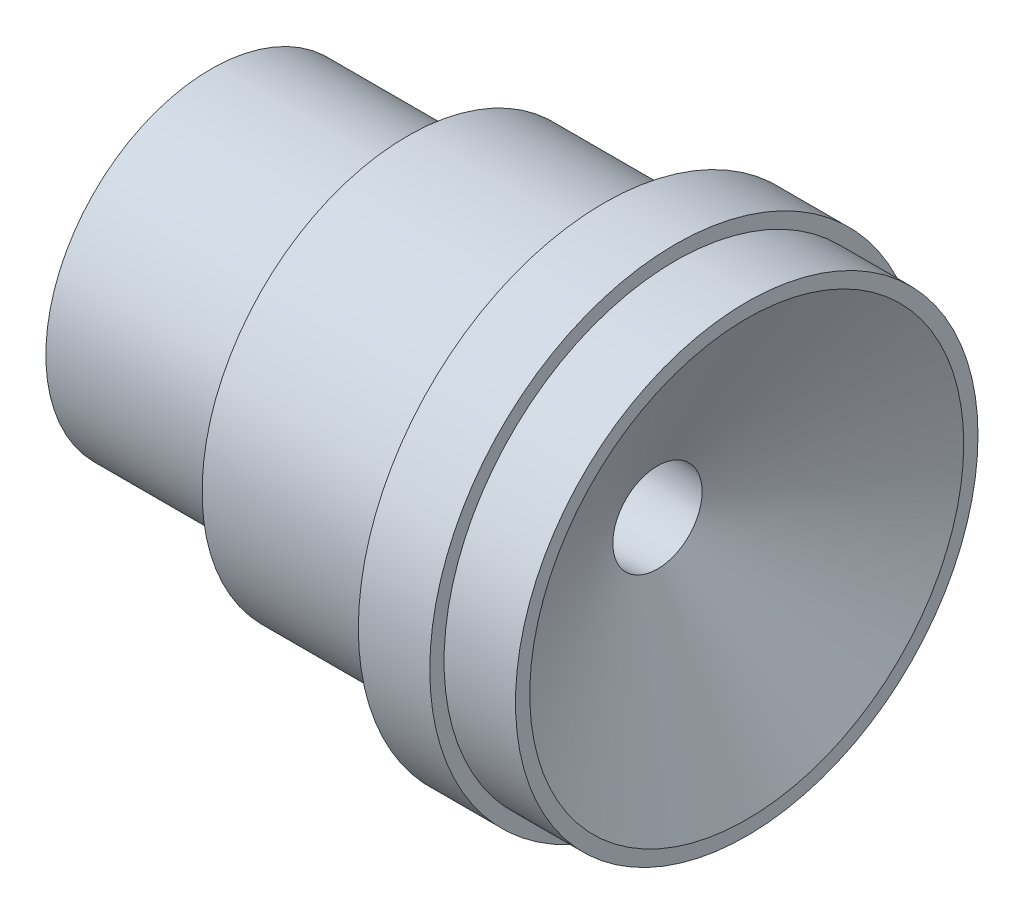
from build123d import *


with BuildPart() as part:
    # Sketch1 → Revolve1 (revolve)
    with BuildSketch(Plane.XY, mode=Mode.PRIVATE) as revolve1_sk:
        Polygon((0, 6.35), (12.7, 30.861), (12.7, 32.893), (2.54, 32.893), (2.54, 34.925), (-7.62, 34.925), (-7.62, 29.21), (-35.56, 29.21), (-35.56, 23.495), (-63.5, 23.495), (-63.5, 10.795), align=None)
    revolve(revolve1_sk.sketch.rotate(Axis((0, 0, 0), (-1, 0, 0)), 90), axis=Axis((0, 0, 0), (-1, 0, 0)))


solid = part.part
